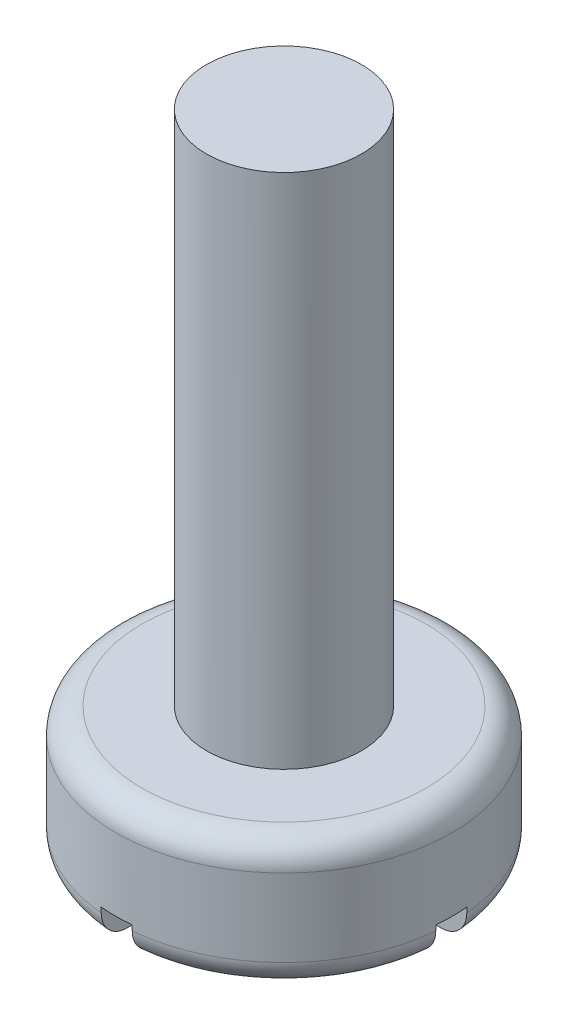
from build123d import *

# Parameters (mm, degrees)
SKETCH1_R           = 3
BOSS_EXTRUDE1_DEPTH = 20
CUT_EXTRUDE1_DEPTH  = 1.2


with BuildPart() as part:
    # Sketch1 → Boss-Extrude1 (new body)
    with BuildSketch(Plane(origin=(0, 0, 0), x_dir=(1, 0, 0), z_dir=(0, 1, 0))):
        with Locations(Location((0, 0, 0), (0, 0, 270))):
            Circle(SKETCH1_R)
    extrude(amount=BOSS_EXTRUDE1_DEPTH)

    # Sketch2 → Revolve1 (revolve)
    with BuildSketch(Plane.XY):
        with BuildLine():
            Line((0, 0), (0, -5))
            Line((0, -5), (-5.5, -5))
            ThreePointArc((-5.5, -5), (-6.207106781, -4.707106781), (-6.5, -4))
            Line((-6.5, -4), (-6.5, -1))
            ThreePointArc((-6.5, -1), (-6.207106781, -0.292893219), (-5.5, 0))
            Line((-5.5, 0), (0, 0))
        make_face()
    revolve(axis=Axis((0, 0, 0), (0, -1, 0)))

    # Sketch3 → Cut-Extrude1 (cut)
    with BuildSketch(Plane.XZ.offset(5)):
        Polygon((0.6, 8.375375313), (-0.6, 8.375375313), (-0.6, 0.8), (-0.8, 0.6), (-7.394108803, 0.6), (-7.394108803, -0.6), (-0.8, -0.6), (-0.6, -0.8), (-0.6, -7.930485814), (0.6, -7.930485814), (0.6, -0.8), (0.8, -0.6), (8.840235389, -0.6), (8.840235389, 0.6), (0.8, 0.6), (0.6, 0.8), align=None)
    extrude(amount=-CUT_EXTRUDE1_DEPTH, mode=Mode.SUBTRACT)


solid = part.part
